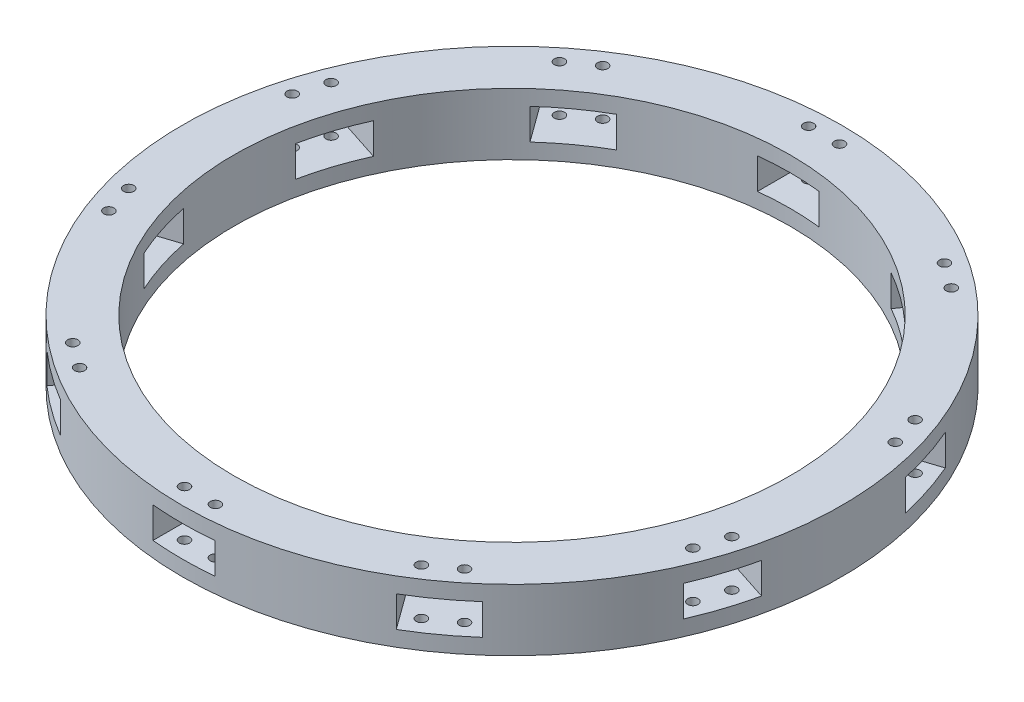
from build123d import *

# Parameters (mm, degrees)
SKETCH1_R           = 320
SKETCH1_R_2         = 270
BOSS_EXTRUDE1_DEPTH = 30
SKETCH2_W           = 60
SKETCH2_H           = 30
CUT_EXTRUDE1_DEPTH  = 454.541618818
CIRPATTERN1_COUNT   = 10
SKETCH3_R           = 5
CUT_EXTRUDE2_DEPTH  = 457.508488421
CIRPATTERN2_COUNT   = 10


with BuildPart() as part:
    # Sketch1 → Boss-Extrude1 (new, symmetric)
    with BuildSketch(Plane(origin=(0, 0, 0), x_dir=(1, 0, 0), z_dir=(0, 1, 0))):
        with Locations(Location((0, 0, 0), (0, 0, 270))):
            Circle(SKETCH1_R)
        with Locations(Location((0, 0, 0), (0, 0, 270))):
            Circle(SKETCH1_R_2, mode=Mode.SUBTRACT)
    extrude(amount=BOSS_EXTRUDE1_DEPTH, both=True)

    # Sketch2 → Cut-Extrude1 (cut, symmetric)
    with BuildSketch(Plane.XY):
        Rectangle(SKETCH2_W, SKETCH2_H)
    cut_extrude1 = extrude(amount=CUT_EXTRUDE1_DEPTH, both=True, mode=Mode.SUBTRACT)

    # CirPattern1: Cut-Extrude1 ×10 about axis
    cirpattern1_axis = Axis((0, 0, 0), (0, 1, 0))
    for i in range(1, CIRPATTERN1_COUNT):
        add(cut_extrude1.rotate(cirpattern1_axis, i * 360 / CIRPATTERN1_COUNT), mode=Mode.SUBTRACT)

    # Sketch3 → Cut-Extrude2 (cut, through all)
    with BuildSketch(Plane(origin=(0, 30, 0), x_dir=(1, 0, 0), z_dir=(0, 1, 0))):
        with Locations(Location((-15, 303, 0), (0, 0, 270))):
            Circle(SKETCH3_R)
        with Locations(Location((15, 303, 0), (0, 0, 270))):
            Circle(SKETCH3_R)
    cut_extrude2 = extrude(amount=-CUT_EXTRUDE2_DEPTH, mode=Mode.SUBTRACT)

    # CirPattern2: Cut-Extrude2 ×10 about axis
    cirpattern2_axis = Axis((0, 0, 0), (0, 1, 0))
    for i in range(1, CIRPATTERN2_COUNT):
        add(cut_extrude2.rotate(cirpattern2_axis, i * 360 / CIRPATTERN2_COUNT), mode=Mode.SUBTRACT)


solid = part.part
